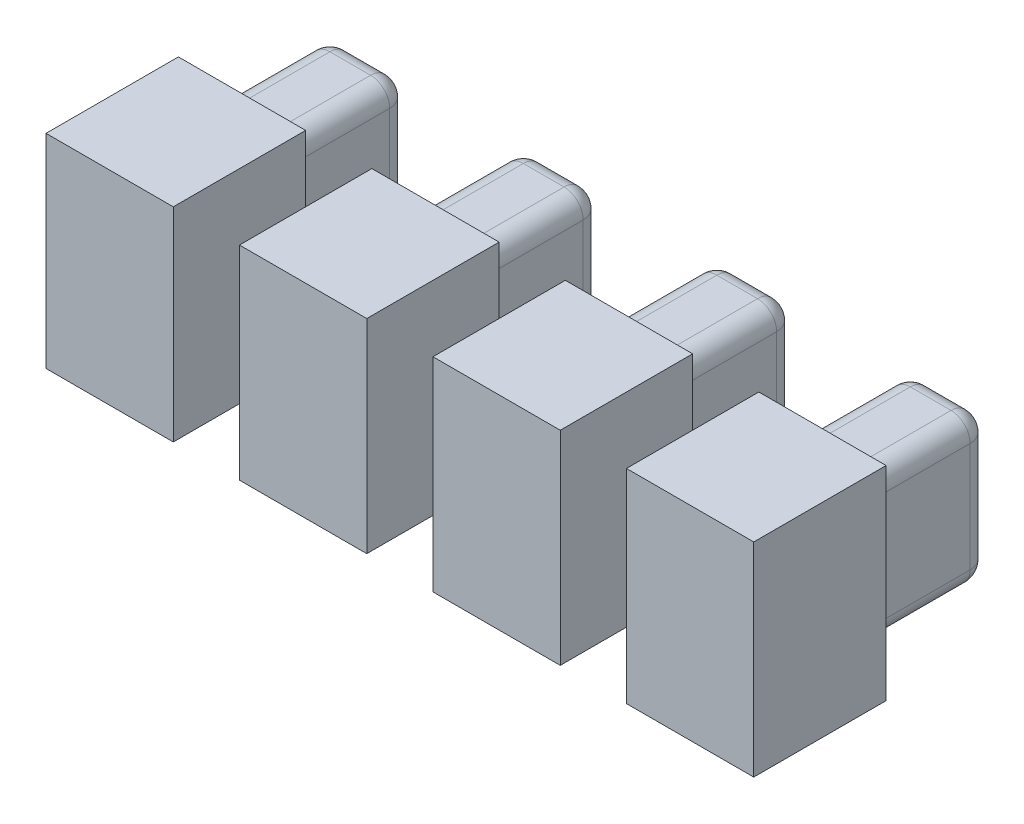
from build123d import *

# Parameters (mm, degrees)
SKETCH_1_W           = 5
SKETCH_1_H           = 8
EXTRUDE_1_DEPTH      = 5.2
EXTRUDE_1_2_DEPTH    = 5.2
EXTRUDE_1_3_DEPTH    = 5.2
EXTRUDE_1_4_DEPTH    = 5.2
SKETCH_2_W           = 3.1
SKETCH_2_H           = 5.8
EXTRUDE_2_DEPTH      = 5
EXTRUDE_3_DEPTH      = 2
EXTRUDE_3_DEPTH_BACK = 1
SKETCH_3_W           = 2.6
SKETCH_3_H           = 0.6
FILLET_1_R           = 0.75


with BuildPart() as part:
    # 草图1 → 凸台-拉伸1 (new body)
    with BuildSketch(Plane.XY):
        with Locations((2.5, 0.600266138)):
            Rectangle(SKETCH_1_W, SKETCH_1_H)
    extrude(amount=EXTRUDE_1_DEPTH)



with BuildPart() as body_2:
    # 草图1 → Extrude 1 2 (new body)
    with BuildSketch(Plane.XY):
        with Locations((-5.1, 0.600266138)):
            Rectangle(SKETCH_1_W, SKETCH_1_H)
    extrude(amount=EXTRUDE_1_2_DEPTH)


with BuildPart() as body_3:
    # 草图1 → Extrude 1 3 (new body)
    with BuildSketch(Plane.XY):
        with Locations((10.1, 0.600266138)):
            Rectangle(SKETCH_1_W, SKETCH_1_H)
    extrude(amount=EXTRUDE_1_3_DEPTH)


with BuildPart() as body_4:
    # 草图1 → Extrude 1 4 (new body)
    with BuildSketch(Plane.XY):
        with Locations((17.7, 0.600266138)):
            Rectangle(SKETCH_1_W, SKETCH_1_H)
    extrude(amount=EXTRUDE_1_4_DEPTH)


with BuildPart() as part_1:
    add(part.part)

    add(body_2.part)  # 凸台-拉伸2 merges body 2

    add(body_3.part)  # 凸台-拉伸2 merges body 3

    add(body_4.part)  # 凸台-拉伸2 merges body 4
    # 草图2 → 凸台-拉伸2 (add)
    with BuildSketch(Plane(origin=(0, 0, 0), x_dir=(-1, 0, 0), z_dir=(0, 0, -1))):
        with Locations((-17.7, 0.600266138)):
            Rectangle(SKETCH_2_W, SKETCH_2_H)
        with Locations((-10.1, 0.600266138)):
            Rectangle(SKETCH_2_W, SKETCH_2_H)
        with Locations((-2.5, 0.600266138)):
            Rectangle(SKETCH_2_W, SKETCH_2_H)
        with Locations((5.1, 0.600266138)):
            Rectangle(SKETCH_2_W, SKETCH_2_H)
    extrude(amount=EXTRUDE_2_DEPTH)

    # 草图3 → 凸台-拉伸3 (add, two sides: drawn at the far end of the back side and taken through both)
    with BuildSketch(Plane(origin=(0, 0, 0), x_dir=(1, 0, 0), z_dir=(0, 1, 0)).offset(-EXTRUDE_3_DEPTH_BACK)):
        with Locations((-1.3, -0.3)):
            Rectangle(SKETCH_3_W, SKETCH_3_H)
        with Locations((6.3, -0.3)):
            Rectangle(SKETCH_3_W, SKETCH_3_H)
        with Locations((13.9, -0.3)):
            Rectangle(SKETCH_3_W, SKETCH_3_H)
    extrude(amount=EXTRUDE_3_DEPTH + EXTRUDE_3_DEPTH_BACK)

    # 圆角1
    fillet_1_edges = [part_1.edges().sort_by_distance(p)[0] for p in [
        (16.15, 3.500266138, -2.5),
        (19.25, 3.500266138, -2.5),
        (19.25, -2.299733862, -2.5),
        (16.15, -2.299733862, -2.5),
        (17.7, 3.500266138, -5),
        (19.25, 0.600266138, -5),
        (17.7, -2.299733862, -5),
        (16.15, 0.600266138, -5),
        (-6.65, 3.500266138, -2.5),
        (-3.55, 3.500266138, -2.5),
        (-3.55, -2.299733862, -2.5),
        (-6.65, -2.299733862, -2.5),
        (-5.1, 3.500266138, -5),
        (-3.55, 0.600266138, -5),
        (-5.1, -2.299733862, -5),
        (-6.65, 0.600266138, -5),
        (0.95, 3.500266138, -2.5),
        (4.05, 3.500266138, -2.5),
        (4.05, -2.299733862, -2.5),
        (0.95, -2.299733862, -2.5),
        (2.5, 3.500266138, -5),
        (4.05, 0.600266138, -5),
        (2.5, -2.299733862, -5),
        (0.95, 0.600266138, -5),
        (8.55, 3.500266138, -2.5),
        (11.65, 3.500266138, -2.5),
        (11.65, -2.299733862, -2.5),
        (8.55, -2.299733862, -2.5),
        (10.1, 3.500266138, -5),
        (11.65, 0.600266138, -5),
        (10.1, -2.299733862, -5),
        (8.55, 0.600266138, -5),
    ]]
    fillet(fillet_1_edges, radius=FILLET_1_R)


solid = part_1.part
